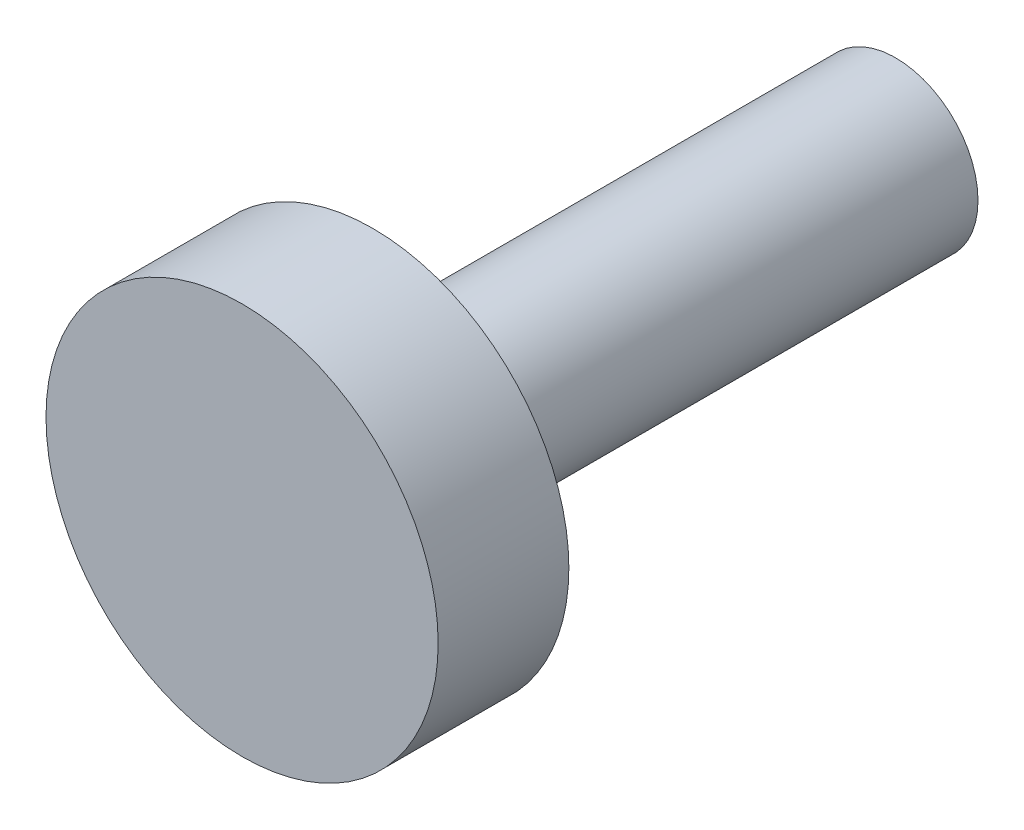
from build123d import *

# Parameters (mm, degrees)
SKETCH1_R           = 9.525
BOSS_EXTRUDE1_DEPTH = 6.35
SKETCH2_R           = 4
BOSS_EXTRUDE2_DEPTH = 25.4


with BuildPart() as part:
    # Sketch1 → Boss-Extrude1 (new body)
    with BuildSketch(Plane.XY):
        Circle(SKETCH1_R)
    extrude(amount=BOSS_EXTRUDE1_DEPTH)

    # Sketch2 → Boss-Extrude2 (add)
    with BuildSketch(Plane.XY):
        Circle(SKETCH2_R)
    extrude(amount=-BOSS_EXTRUDE2_DEPTH)


solid = part.part
